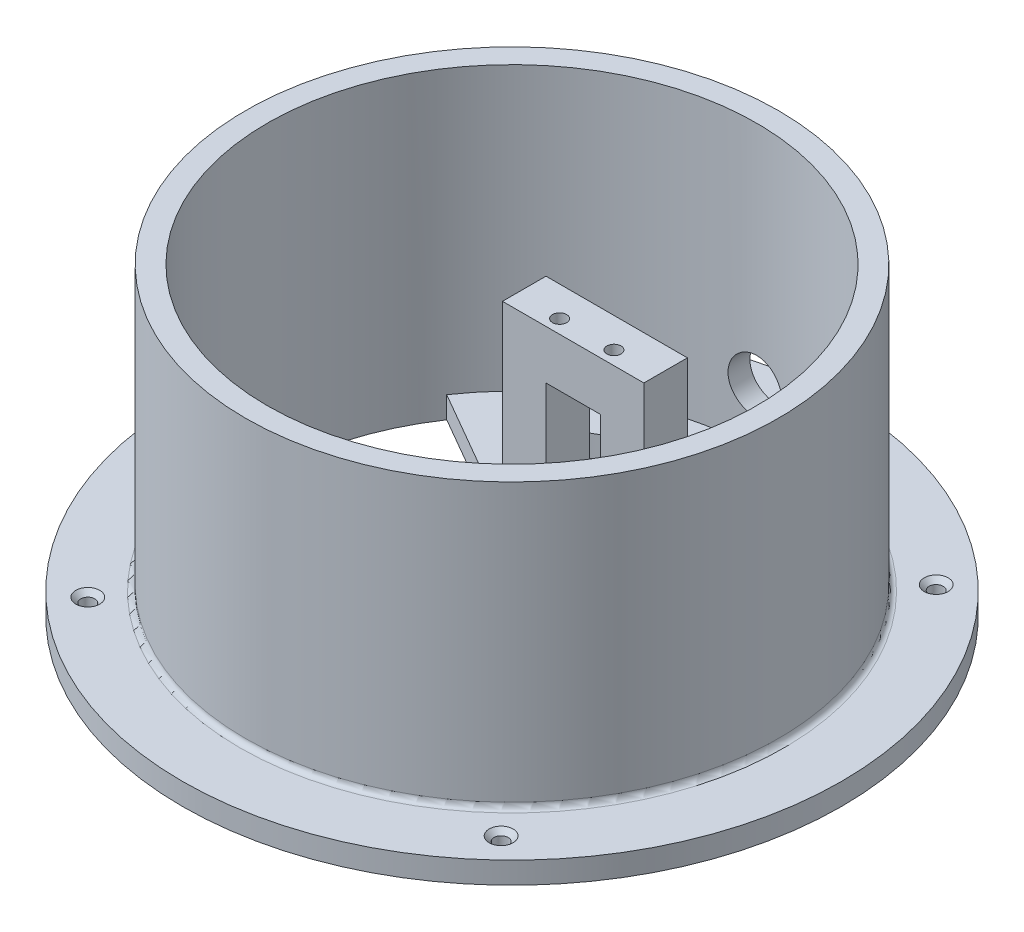
from build123d import *

# Parameters (mm, degrees)
SKETCH3_R                                            = 60.625
SKETCH3_R_2                                          = 45
BOSS_EXTRUDE1_DEPTH                                  = 4
SKETCH5_R                                            = 49
SKETCH5_R_2                                          = 45
BOSS_EXTRUDE2_DEPTH                                  = 52
SKETCH6_W                                            = 8
SKETCH6_H                                            = 38
BOSS_EXTRUDE3_DEPTH                                  = 13
SKETCH7_W                                            = 10
SKETCH7_H                                            = 24
CUT_EXTRUDE1_DEPTH                                   = 26
SKETCH8_R                                            = 5
CUT_EXTRUDE2_DEPTH                                   = 55
SKETCH9_R                                            = 1.3
CUT_EXTRUDE5_DEPTH                                   = 7.2
BOSS_EXTRUDE5_DEPTH                                  = 4
CSK_FOR_ST2_2_CROSS_RECESSED_CTSK_HEAD_T_D           = 2.6
CSK_FOR_ST2_2_CROSS_RECESSED_CTSK_HEAD_T_CSINK_D     = 4.4
CSK_FOR_ST2_2_CROSS_RECESSED_CTSK_HEAD_T_CSINK_ANGLE = 90
FILLET1_R                                            = 1


with BuildPart() as part:
    # Sketch3 → Boss-Extrude1 (new body)
    with BuildSketch(Plane(origin=(0, 0, 0), x_dir=(1, 0, 0), z_dir=(0, 1, 0))):
        with Locations(Location((0, 0, 0), (0, 0, 270))):
            Circle(SKETCH3_R)
        with Locations(Location((0, 0, 0), (0, 0, 270))):
            Circle(SKETCH3_R_2, mode=Mode.SUBTRACT)
    extrude(amount=BOSS_EXTRUDE1_DEPTH)

    # Sketch5 → Boss-Extrude2 (add)
    with BuildSketch(Plane(origin=(0, 4, 0), x_dir=(1, 0, 0), z_dir=(0, 1, 0))):
        with Locations(Location((0, 0, 0), (0, 0, 90))):
            Circle(SKETCH5_R)
        with Locations(Location((0, 0, 0), (0, 0, 270))):
            Circle(SKETCH5_R_2, mode=Mode.SUBTRACT)
    extrude(amount=BOSS_EXTRUDE2_DEPTH)

    # Sketch6 → Boss-Extrude3 (add, symmetric)
    with BuildSketch(Plane(origin=(0, 0, 0), x_dir=(0, 0, -1), z_dir=(1, 0, 0))):
        Polygon((-46.75, 38), (-31.75, 38), (-31.75, 30), (-45, 16.75), (-46.75, 15), (-46.75, 30), align=None)
        with Locations((15.25, 19)):
            Rectangle(SKETCH6_W, SKETCH6_H)
    extrude(amount=BOSS_EXTRUDE3_DEPTH, both=True)


with BuildPart() as boss_extrude3_piece_1:
    # of the separate pieces the step leaves, piece 1, a body of its own (boss_extrude3_pieces)
    add(part.part.solids().sort_by_distance((0, 0, 60.625))[0])

    # Sketch8 → Cut-Extrude2 (cut)
    with BuildSketch(Plane.XY.offset(-11.25)):
        with Locations(Location((0, 14, 0), (0, 0, 90))):
            Circle(SKETCH8_R)
    extrude(amount=-CUT_EXTRUDE2_DEPTH, mode=Mode.SUBTRACT)


with BuildPart() as boss_extrude3_piece_2:
    # of the separate pieces the step leaves, piece 2, a body of its own (boss_extrude3_pieces)
    add(part.part.solids().sort_by_distance((-13, 38, -11.25))[0])

    # Sketch7 → Cut-Extrude1 (cut)
    with BuildSketch(Plane.XY.offset(-11.25)):
        with Locations((0, 17)):
            Rectangle(SKETCH7_W, SKETCH7_H)
    extrude(amount=-CUT_EXTRUDE1_DEPTH, mode=Mode.SUBTRACT)


with BuildPart() as cut_extrude5_tool:
    # Sketch9 → Cut-Extrude5 (new body)
    with BuildSketch(Plane(origin=(0, 38, 0), x_dir=(1, 0, 0), z_dir=(0, 1, 0))):
        with Locations(Location((5, 13.75, 0), (0, 0, 270))):
            Circle(SKETCH9_R)
        with Locations(Location((5, -34.25, 0), (0, 0, 270))):
            Circle(SKETCH9_R)
        with Locations(Location((-5, -34.25, 0), (0, 0, 270))):
            Circle(SKETCH9_R)
        with Locations(Location((-5, 13.75, 0), (0, 0, 270))):
            Circle(SKETCH9_R)
    extrude(amount=-CUT_EXTRUDE5_DEPTH)


with BuildPart() as boss_extrude3_piece_1_1:
    add(boss_extrude3_piece_1.part)

    # Cut-Extrude5: cut by cut_extrude5_tool
    add(cut_extrude5_tool.part, mode=Mode.SUBTRACT)



with BuildPart() as boss_extrude3_piece_2_1:
    add(boss_extrude3_piece_2.part)

    # Cut-Extrude5: cut by cut_extrude5_tool
    add(cut_extrude5_tool.part, mode=Mode.SUBTRACT)


with BuildPart() as boss_extrude3_piece_1_2:
    add(boss_extrude3_piece_1_1.part)

    add(boss_extrude3_piece_2_1.part)  # Boss-Extrude5 merges Boss-Extrude3 piece 2
    # Sketch10 → Boss-Extrude5 (add)
    with BuildSketch(Plane.XZ):
        with BuildLine():
            Line((37.248431585, -25.249838503), (13, -11.25))
            Line((13, -11.25), (-13, -11.25))
            Line((-13, -11.25), (-37.248431585, -25.249838503))
            ThreePointArc((-37.248431585, -25.249838503), (0, -45), (37.248431585, -25.249838503))
        make_face()
        with BuildLine():
            Line((-19.516660498, -24.25), (19.516660498, -24.25))
            Line((19.516660498, -24.25), (24.906460381, -27.361802413))
            ThreePointArc((24.906460381, -27.361802413), (0, -37), (-24.906460381, -27.361802413))
            Line((-24.906460381, -27.361802413), (-19.516660498, -24.25))
        make_face(mode=Mode.SUBTRACT)
    extrude(amount=-BOSS_EXTRUDE5_DEPTH)

    # CSK for ST2.2 Cross recessed CTSK head tapping screws1 (through all)
    with Locations(Plane(origin=(0, 4, 0), x_dir=(1, 0, 0), z_dir=(0, 1, 0))):
        with Locations((0, 0), (38, -40), (-38, 40), (-38, -40), (38, 40)):
            CounterSinkHole(CSK_FOR_ST2_2_CROSS_RECESSED_CTSK_HEAD_T_D / 2, CSK_FOR_ST2_2_CROSS_RECESSED_CTSK_HEAD_T_CSINK_D / 2, counter_sink_angle=CSK_FOR_ST2_2_CROSS_RECESSED_CTSK_HEAD_T_CSINK_ANGLE)

    # Fillet1
    fillet1_edges = [boss_extrude3_piece_1_2.edges().sort_by_distance(p)[0] for p in [
        (0, 4, 49),
    ]]
    fillet(fillet1_edges, radius=FILLET1_R)


solid = boss_extrude3_piece_1_2.part
